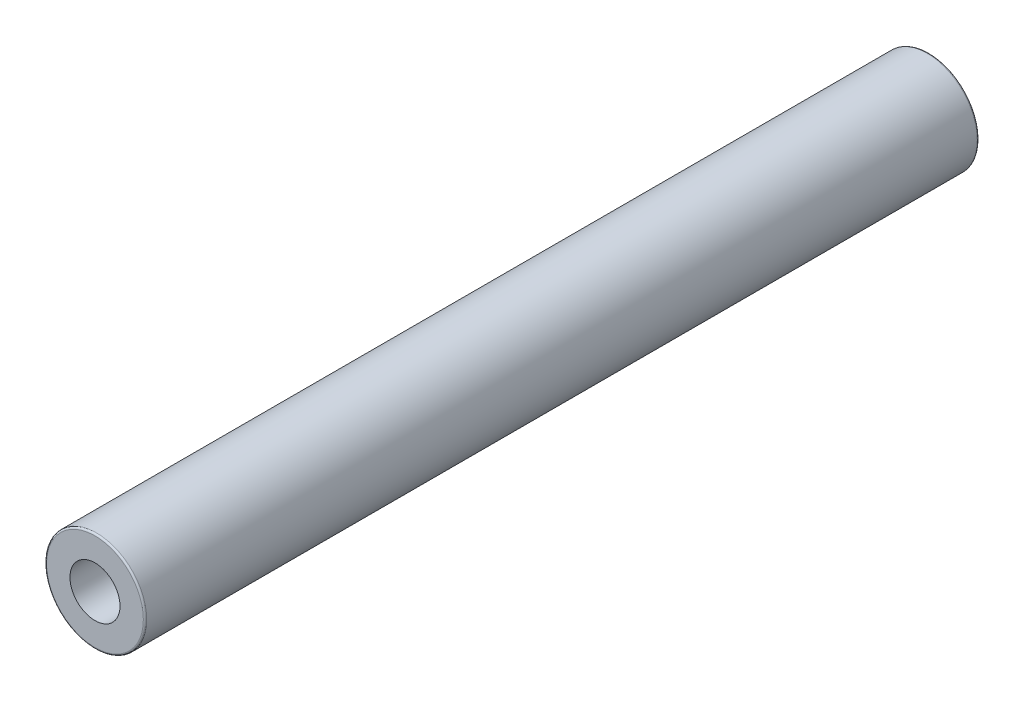
from build123d import *

# Parameters (mm, degrees)
SKETCH_1_R      = 3
SKETCH_1_R_2    = 1.5
EXTRUDE_1_DEPTH = 50
FILLET_1_R      = 0.1


with BuildPart() as part:
    # ｽｹｯﾁ1 → ﾎﾞｽ - 押し出し1 (new body)
    with BuildSketch(Plane.XY):
        Circle(SKETCH_1_R)
        Circle(SKETCH_1_R_2, mode=Mode.SUBTRACT)
    extrude(amount=EXTRUDE_1_DEPTH)

    # ﾌｨﾚｯﾄ1
    fillet_1_edges = [part.edges().sort_by_distance(p)[0] for p in [
        (-3, 0, 0),
        (-3, 0, 50),
    ]]
    fillet(fillet_1_edges, radius=FILLET_1_R)


solid = part.part
